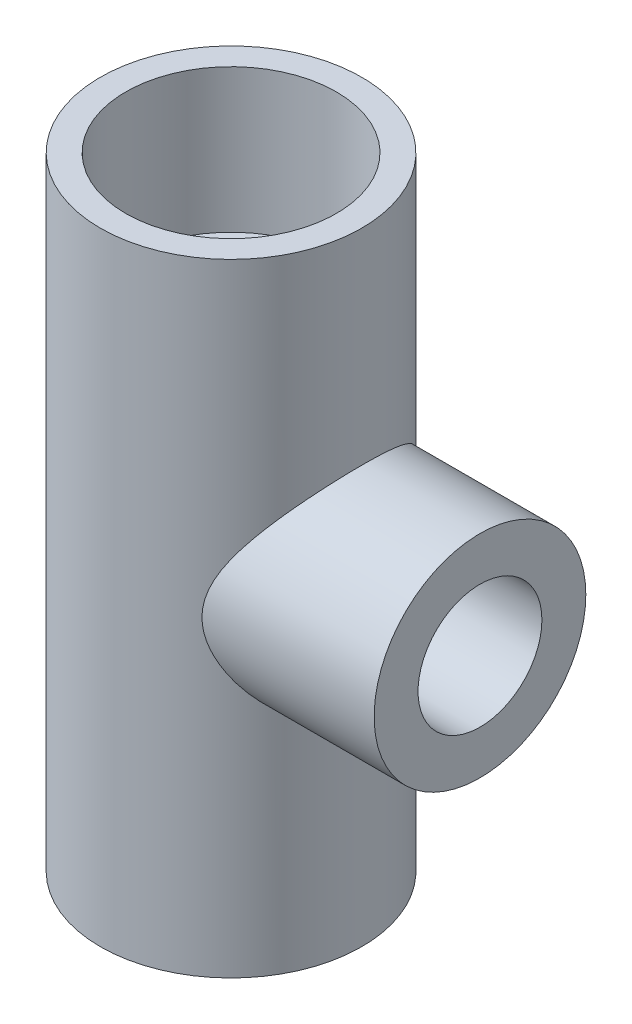
from build123d import *

# Parameters (mm, degrees)
SKETCH1_R                = 0.6565
SKETCH1_R_2              = 0.412
BOSS_EXTRUDE1_DEPTH      = 1.5625
SKETCH1_3_R              = 0.529
SKETCH1_3_R_2            = 0.412
CUT_EXTRUDE1_DEPTH       = 0.72
BOSS_EXTRUDE2_REACH      = 5.719
BOSS_EXTRUDE2_END_RADIUS = 0.6565
SKETCH2_R                = 0.5315
SKETCH2_R_2              = 0.311
CUT_EXTRUDE2_REACH       = 5.719
SKETCH2_3_R              = 0.311


with BuildPart() as part:
    # Sketch1 → Boss-Extrude1 (new body)
    with BuildSketch(Plane(origin=(0, 0, 0), x_dir=(1, 0, 0), z_dir=(0, 1, 0))):
        Circle(SKETCH1_R)
        Circle(SKETCH1_R_2, mode=Mode.SUBTRACT)
    boss_extrude1 = extrude(amount=BOSS_EXTRUDE1_DEPTH)

    # Sketch1<3> → Cut-Extrude1 (cut)
    with BuildSketch(Plane(origin=(0, 0, 0), x_dir=(1, 0, 0), z_dir=(0, 1, 0))):
        Circle(SKETCH1_3_R)
        Circle(SKETCH1_3_R_2, mode=Mode.SUBTRACT)
    cut_extrude1 = extrude(amount=CUT_EXTRUDE1_DEPTH, mode=Mode.SUBTRACT)

    # Mirror1: Boss-Extrude1, Cut-Extrude1 across plane
    add(boss_extrude1.mirror(Plane.ZX.offset(1.5625)))
    add(cut_extrude1.mirror(Plane.ZX.offset(1.5625)), mode=Mode.SUBTRACT)

    # Boss-Extrude2: up to this cylinder (the profile starts outside it)
    boss_extrude2_end = Plane(origin=(0, 1.5625, 0), z_dir=(0, -1, 0)) * Cylinder(BOSS_EXTRUDE2_END_RADIUS, 13.751, mode=Mode.PRIVATE)
    # Sketch2 → Boss-Extrude2 (add, up to the surface)
    with BuildSketch(Plane(origin=(1.25, 0, 0), x_dir=(0, 0, -1), z_dir=(1, 0, 0)), mode=Mode.PRIVATE) as boss_extrude2_sk1:
        with Locations((0, 1.5625)):
            Circle(SKETCH2_R)
        with Locations((0, 1.5625)):
            Circle(SKETCH2_R_2, mode=Mode.SUBTRACT)
    boss_extrude2_tool1 = extrude(boss_extrude2_sk1.sketch, amount=-BOSS_EXTRUDE2_REACH, mode=Mode.PRIVATE) - boss_extrude2_end
    add(boss_extrude2_tool1.solids().sort_by_distance((1.25, 1.5625, 0.516467))[0])

    # Sketch2<3> → Cut-Extrude2 (cut, up to next)
    with BuildSketch(Plane(origin=(1.25, 0, 0), x_dir=(0, 0, -1), z_dir=(1, 0, 0)), mode=Mode.PRIVATE) as cut_extrude2_sk1:
        with Locations((0, 1.5625)):
            Circle(SKETCH2_3_R)
    cut_extrude2_tool1 = extrude(cut_extrude2_sk1.sketch, amount=-CUT_EXTRUDE2_REACH, mode=Mode.PRIVATE) & part.part
    add(cut_extrude2_tool1.solids().sort_by_distance((1.25, 1.5625, 0))[0], mode=Mode.SUBTRACT)


solid = part.part
